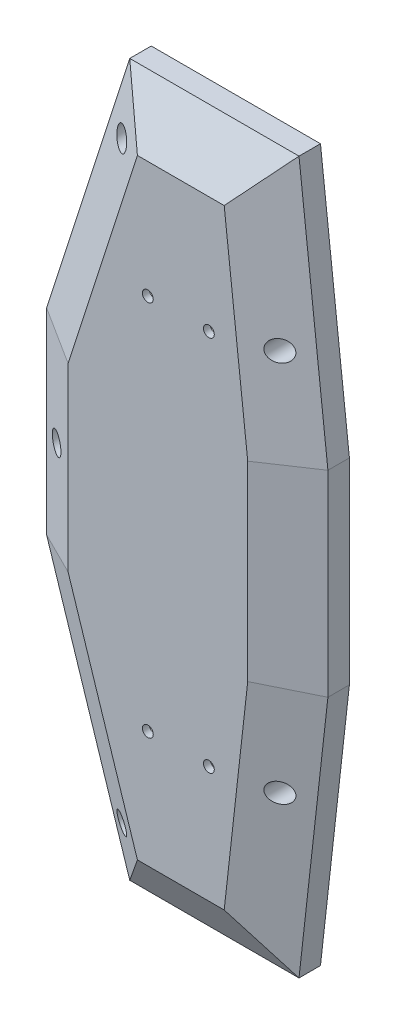
from build123d import *

# Parameters (mm, degrees)
EXTRUDE1_DEPTH     = 15
CHAMFER1_SIZE      = 15
CHAMFER1_SIZE2     = 8.660254038
SHELL1_T           = -2
EXTRUDE2_REACH     = 119.048
SKETCH2_R          = 4
SKETCH2_R_2        = 1.6
SKETCH3_R          = 3
CUT_EXTRUDE1_DEPTH = 15
SKETCH5_R          = 1.6
CUT_EXTRUDE2_DEPTH = 20


with BuildPart() as part:
    # Sketch1 → Extrude1 (new body)
    with BuildSketch(Plane.XY):
        Polygon((-24.967783135, 105), (-49.5, 29), (-49.5, -29), (-24.967783135, -105), (24.967783135, -105), (33.5, -29), (33.5, 29), (24.967783135, 105), align=None)
    extrude(amount=EXTRUDE1_DEPTH)

    # Chamfer1
    chamfer1_edges = [part.edges().sort_by_distance(p)[0] for p in [
        (-49.5, 0, 15),
        (-37.233891568, -67, 15),
        (0, -105, 15),
        (29.233891568, -67, 15),
        (33.5, 0, 15),
        (29.233891568, 67, 15),
        (0, 105, 15),
        (-37.233891568, 67, 15),
    ]]
    chamfer1_side = [part.faces().sort_by_distance(p)[0] for p in [
        (-5.515477183, 0, 15),
    ]]
    chamfer(chamfer1_edges, length=CHAMFER1_SIZE, length2=CHAMFER1_SIZE2, reference=chamfer1_side[0])

    # Shell1
    shell1_openings = [part.faces().sort_by_distance(p)[0] for p in [
        (-5.515477183, 0, 0),
    ]]
    offset(amount=SHELL1_T, openings=shell1_openings, kind=Kind.INTERSECTION)

    # Sketch2 → Extrude2 (add, up to next)
    with BuildSketch(Plane(origin=(0, 0, 0), x_dir=(-1, 0, 0), z_dir=(0, 0, -1)), mode=Mode.PRIVATE) as extrude2_sk1:
        with Locations((23.2777341, 87.448162672)):
            Circle(SKETCH2_R)
        with Locations((23.2777341, 87.448162672)):
            Circle(SKETCH2_R_2, mode=Mode.SUBTRACT)
    extrude2_tool1 = extrude(extrude2_sk1.sketch, amount=-EXTRUDE2_REACH, mode=Mode.PRIVATE) - part.part
    # Sketch2 → Extrude2 (add, up to next)
    with BuildSketch(Plane(origin=(0, 0, 0), x_dir=(-1, 0, 0), z_dir=(0, 0, -1)), mode=Mode.PRIVATE) as extrude2_sk2:
        with Locations((-23.372488986, 56.466339116)):
            Circle(SKETCH2_R)
        with Locations((-23.372488986, 56.466339116)):
            Circle(SKETCH2_R_2, mode=Mode.SUBTRACT)
    extrude2_tool2 = extrude(extrude2_sk2.sketch, amount=-EXTRUDE2_REACH, mode=Mode.PRIVATE) - part.part
    # Sketch2 → Extrude2 (add, up to next)
    with BuildSketch(Plane(origin=(0, 0, 0), x_dir=(-1, 0, 0), z_dir=(0, 0, -1)), mode=Mode.PRIVATE) as extrude2_sk3:
        with Locations((42.5, 0)):
            Circle(SKETCH2_R)
        with Locations((42.5, 0)):
            Circle(SKETCH2_R_2, mode=Mode.SUBTRACT)
    extrude2_tool3 = extrude(extrude2_sk3.sketch, amount=-EXTRUDE2_REACH, mode=Mode.PRIVATE) - part.part
    # Sketch2 → Extrude2 (add, up to next)
    with BuildSketch(Plane(origin=(0, 0, 0), x_dir=(-1, 0, 0), z_dir=(0, 0, -1)), mode=Mode.PRIVATE) as extrude2_sk4:
        with Locations((-23.372488986, -56.466339116)):
            Circle(SKETCH2_R)
        with Locations((-23.372488986, -56.466339116)):
            Circle(SKETCH2_R_2, mode=Mode.SUBTRACT)
    extrude2_tool4 = extrude(extrude2_sk4.sketch, amount=-EXTRUDE2_REACH, mode=Mode.PRIVATE) - part.part
    # Sketch2 → Extrude2 (add, up to next)
    with BuildSketch(Plane(origin=(0, 0, 0), x_dir=(-1, 0, 0), z_dir=(0, 0, -1)), mode=Mode.PRIVATE) as extrude2_sk5:
        with Locations((23.2777341, -87.448162672)):
            Circle(SKETCH2_R)
        with Locations((23.2777341, -87.448162672)):
            Circle(SKETCH2_R_2, mode=Mode.SUBTRACT)
    extrude2_tool5 = extrude(extrude2_sk5.sketch, amount=-EXTRUDE2_REACH, mode=Mode.PRIVATE) - part.part
    add(extrude2_tool1.solids().sort_by_distance((-19.390871, 87.448163, 0))[0])
    add(extrude2_tool2.solids().sort_by_distance((27.259352, 56.466339, 0))[0])
    add(extrude2_tool3.solids().sort_by_distance((-38.613137, 0, 0))[0])
    add(extrude2_tool4.solids().sort_by_distance((27.259352, -56.466339, 0))[0])
    add(extrude2_tool5.solids().sort_by_distance((-19.390871, -87.448163, 0))[0])

    # Sketch3 → Cut-Extrude1 (cut)
    with BuildSketch(Plane(origin=(0, 0, 3), x_dir=(-1, 0, 0), z_dir=(0, 0, -1))):
        with Locations((23.2777341, 87.448162672)):
            Circle(SKETCH3_R)
        with Locations((-23.372488986, 56.466339116)):
            Circle(SKETCH3_R)
        with Locations((-23.372488986, -56.466339116)):
            Circle(SKETCH3_R)
        with Locations((23.2777341, -87.448162672)):
            Circle(SKETCH3_R)
        with Locations((42.5, 0)):
            Circle(SKETCH3_R)
    extrude(amount=-CUT_EXTRUDE1_DEPTH, mode=Mode.SUBTRACT)

    # Sketch5 → Cut-Extrude2 (cut)
    with BuildSketch(Plane.XY.offset(19)):
        with Locations((-10.967783135, 55.6)):
            Circle(SKETCH5_R)
        with Locations((7.032216865, 55.6)):
            Circle(SKETCH5_R)
        with Locations((7.032216865, -55.6)):
            Circle(SKETCH5_R)
        with Locations((-10.967783135, -55.6)):
            Circle(SKETCH5_R)
    extrude(amount=-CUT_EXTRUDE2_DEPTH, mode=Mode.SUBTRACT)


solid = part.part
